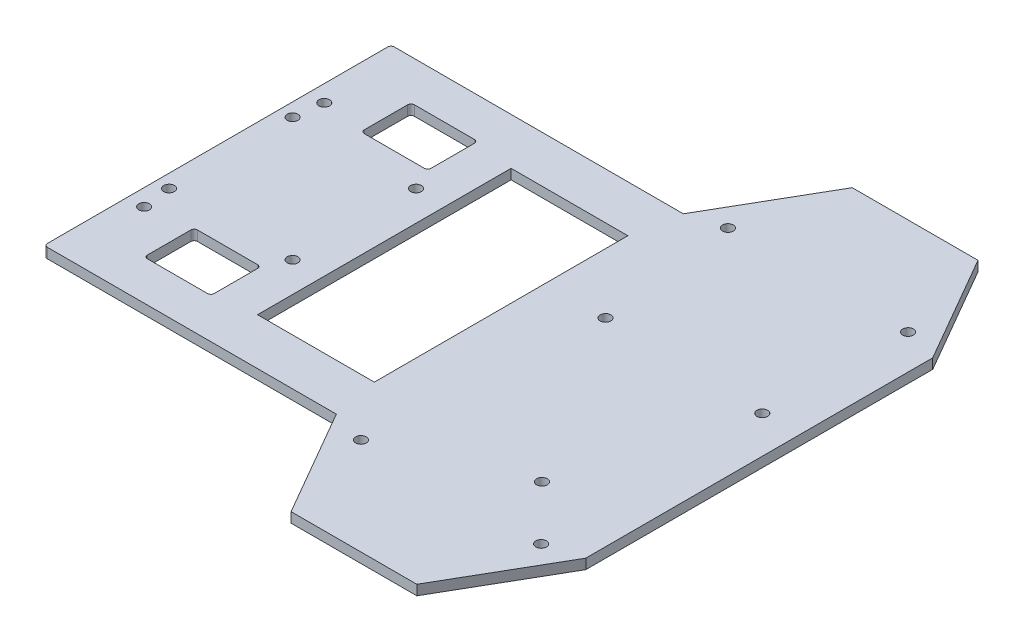
from build123d import *

# Parameters (mm, degrees)
BOSS_EXTRUDE1_DEPTH                        = 3
FILLET1_R                                  = 1
SKETCH2_R                                  = 1.6
MOTOR_DRIVER_HOLES_DEPTH                   = 183.893494651
SKETCH3_W                                  = 20
SKETCH3_H                                  = 15
MOTOR_DRIVER_ROUTING_POCKET_DEPTH          = 183.893494651
MOTOR_DRIVER_ROUTING_POCKET_FILLETS_R      = 1
MOTOR_DRIVER_ROUTING_POCKET_FILLETS_OF_M_R = 1
SKETCH5_W                                  = 35
SKETCH5_H                                  = 76
BATTERY_SEAT_DEPTH                         = 183.893494651
SKETCH6_R                                  = 1.6
MICROCONTROLLER_STANDOFF_HOLES_DEPTH       = 183.893494651
SKETCH8_R                                  = 1.6
PLATE_STANDOFF_HOLES_DEPTH                 = 183.893494651


with BuildPart() as part:
    # Sketch1 → Boss-Extrude1 (new body)
    with BuildSketch(Plane(origin=(0, 0, 0), x_dir=(1, 0, 0), z_dir=(0, 1, 0))):
        Polygon((0, 52), (0, -52), (87.617056359, -52), (106.15, -84.1), (143.85, -84.1), (162.382943641, -52), (162.382943641, 52), (143.85, 84.1), (106.15, 84.1), (87.617056359, 52), align=None)
    extrude(amount=BOSS_EXTRUDE1_DEPTH)

    # Fillet1
    fillet1_edges = [part.edges().sort_by_distance(p)[0] for p in [
        (0, 1.5, 52),
        (0, 1.5, -52),
    ]]
    fillet(fillet1_edges, radius=FILLET1_R)

    # Sketch2 → Motor Driver Holes (cut, through all)
    with BuildSketch(Plane(origin=(0, 3, 0), x_dir=(1, 0, 0), z_dir=(0, 1, 0))):
        with Locations(Location((4, 18.5, 0), (0, 0, 270))):
            Circle(SKETCH2_R)
        with Locations(Location((41, 18.5, 0), (0, 0, 270))):
            Circle(SKETCH2_R)
        with Locations(Location((4, -18.5, 0), (0, 0, 270))):
            Circle(SKETCH2_R)
        with Locations(Location((41, -18.5, 0), (0, 0, 270))):
            Circle(SKETCH2_R)
    extrude(amount=-MOTOR_DRIVER_HOLES_DEPTH, mode=Mode.SUBTRACT)

    # Sketch3 → Motor Driver Routing Pocket (cut, through all)
    with BuildSketch(Plane(origin=(0, 3, 0), x_dir=(1, 0, 0), z_dir=(0, 1, 0))):
        with Locations((28, 32.5)):
            Rectangle(SKETCH3_W, SKETCH3_H)
    motor_driver_routing_pocket = extrude(amount=-MOTOR_DRIVER_ROUTING_POCKET_DEPTH, mode=Mode.SUBTRACT)

    # Motor Driver Routing Pocket Fillets
    motor_driver_routing_pocket_fillets_edges = [part.edges().sort_by_distance(p)[0] for p in [
        (38, 1.5, -40),
        (38, 1.5, -25),
        (18, 1.5, -25),
        (18, 1.5, -40),
    ]]
    fillet(motor_driver_routing_pocket_fillets_edges, radius=MOTOR_DRIVER_ROUTING_POCKET_FILLETS_R)

    # Mirror1: Motor Driver Routing Pocket across plane
    add(motor_driver_routing_pocket.mirror(Plane.XY), mode=Mode.SUBTRACT)

    # Motor Driver Routing Pocket Fillets of M
    motor_driver_routing_pocket_fillets_of_m_edges = [part.edges().sort_by_distance(p)[0] for p in [
        (38, 1.5, 40),
        (38, 1.5, 25),
        (18, 1.5, 25),
        (18, 1.5, 40),
    ]]
    fillet(motor_driver_routing_pocket_fillets_of_m_edges, radius=MOTOR_DRIVER_ROUTING_POCKET_FILLETS_OF_M_R)

    # Sketch5 → Battery Seat (cut, through all)
    with BuildSketch(Plane(origin=(0, 3, 0), x_dir=(1, 0, 0), z_dir=(0, 1, 0))):
        with Locations((67.5, 0)):
            Rectangle(SKETCH5_W, SKETCH5_H)
    extrude(amount=-BATTERY_SEAT_DEPTH, mode=Mode.SUBTRACT)

    # Sketch6 → Microcontroller Standoff Holes (cut, through all)
    with BuildSketch(Plane(origin=(0, 3, 0), x_dir=(1, 0, 0), z_dir=(0, 1, 0))):
        with Locations(Location((136, -38.75, 0), (0, 0, 270))):
            Circle(SKETCH6_R)
        with Locations(Location((151.24, 12.05, 0), (0, 0, 270))):
            Circle(SKETCH6_R)
        with Locations(Location((102.98, 13.32, 0), (0, 0, 270))):
            Circle(SKETCH6_R)
    extrude(amount=-MICROCONTROLLER_STANDOFF_HOLES_DEPTH, mode=Mode.SUBTRACT)

    # Sketch8 → Plate Standoff Holes (cut, through all)
    with BuildSketch(Plane(origin=(0, 3, 0), x_dir=(1, 0, 0), z_dir=(0, 1, 0))):
        with Locations(Location((5, 27, 0), (0, 0, 270))):
            Circle(SKETCH8_R)
        with Locations(Location((5, -27, 0), (0, 0, 270))):
            Circle(SKETCH8_R)
        with Locations(Location((98, -55, 0), (0, 0, 270))):
            Circle(SKETCH8_R)
        with Locations(Location((98, 55, 0), (0, 0, 270))):
            Circle(SKETCH8_R)
        with Locations(Location((152, -55, 0), (0, 0, 270))):
            Circle(SKETCH8_R)
        with Locations(Location((152, 55, 0), (0, 0, 270))):
            Circle(SKETCH8_R)
    extrude(amount=-PLATE_STANDOFF_HOLES_DEPTH, mode=Mode.SUBTRACT)


solid = part.part
